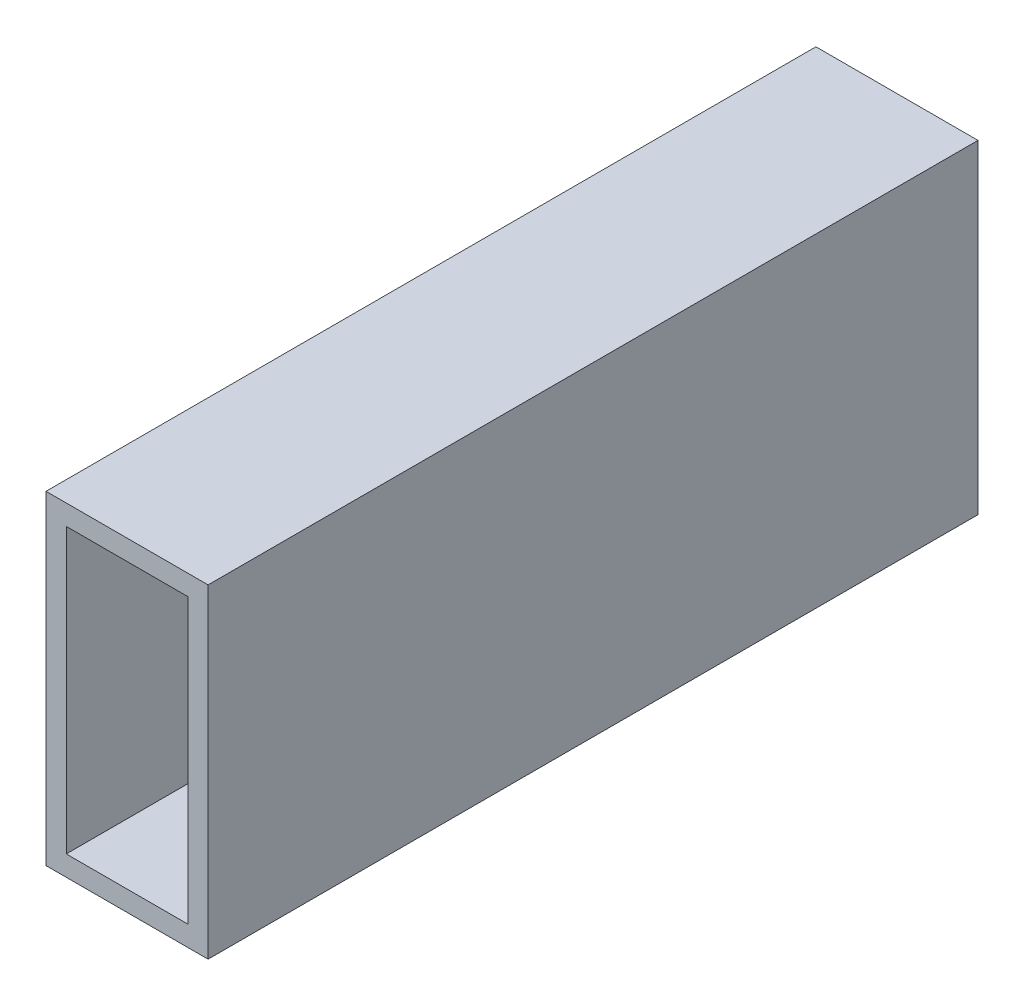
from build123d import *

# Parameters (mm, degrees)
SKETCH1_W           = 25.4
SKETCH1_H           = 50.8
SKETCH1_W_2         = 19.05
SKETCH1_H_2         = 44.45
BOSS_EXTRUDE1_DEPTH = 120.65


with BuildPart() as part:
    # Sketch1 → Boss-Extrude1 (new body)
    with BuildSketch(Plane.XY):
        with Locations((12.7, 25.4)):
            Rectangle(SKETCH1_W, SKETCH1_H)
        with Locations((12.7, 25.4)):
            Rectangle(SKETCH1_W_2, SKETCH1_H_2, mode=Mode.SUBTRACT)
    extrude(amount=BOSS_EXTRUDE1_DEPTH)


solid = part.part
